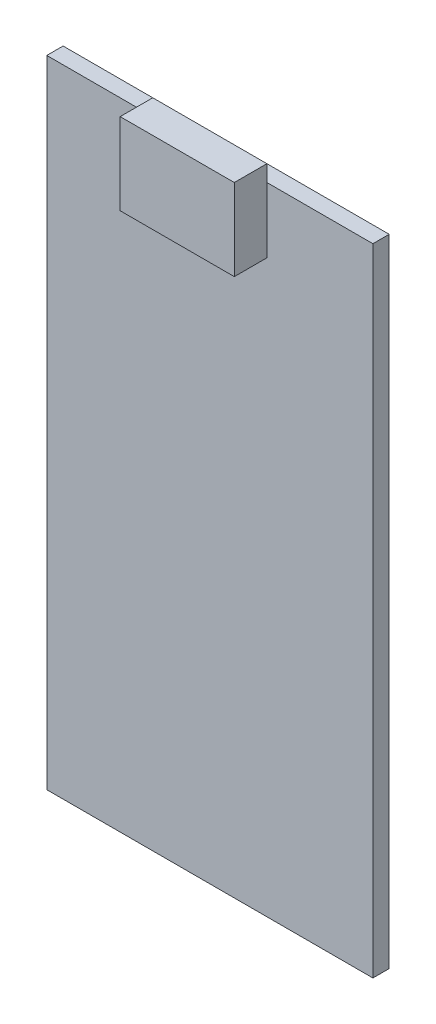
from build123d import *

# Parameters (mm, degrees)
SKETCH_1_W      = 20
SKETCH_1_H      = 39
EXTRUDE_1_DEPTH = 1
SKETCH_2_W      = 7
SKETCH_2_H      = 5
EXTRUDE_2_DEPTH = 2


with BuildPart() as part:
    # ｽｹｯﾁ1 → ﾎﾞｽ - 押し出し1 (new body)
    with BuildSketch(Plane.XY):
        Rectangle(SKETCH_1_W, SKETCH_1_H)
    extrude(amount=EXTRUDE_1_DEPTH)

    # ｽｹｯﾁ2 → ﾎﾞｽ - 押し出し2 (add)
    with BuildSketch(Plane.XY.offset(1)):
        with Locations((0, 18)):
            Rectangle(SKETCH_2_W, SKETCH_2_H)
    extrude(amount=EXTRUDE_2_DEPTH)


solid = part.part
